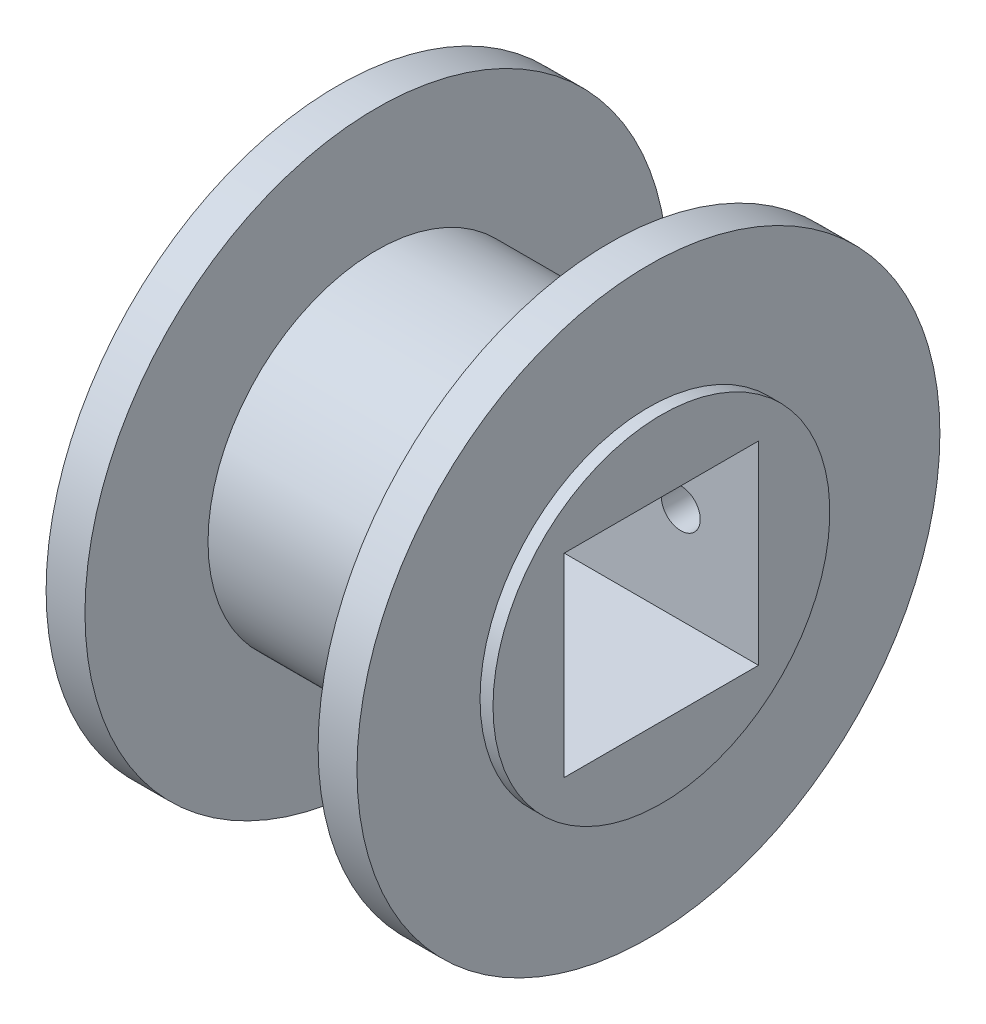
from build123d import *

# Parameters (mm, degrees)
SCHIZZO2_W               = 15
SCHIZZO2_H               = 15
TAGLIO_ESTRUSIONE1_DEPTH = 42.091361623
SCHIZZO3_R               = 1.5
TAGLIO_ESTRUSIONE2_DEPTH = 35.372954485


with BuildPart() as part:
    # Schizzo1 → Rivoluzione1 (revolve)
    with BuildSketch(Plane.XY, mode=Mode.PRIVATE) as rivoluzione1_sk:
        Polygon((-13, 0), (13, 0), (13, 13), (12, 13), (12, 22.5), (9, 22.5), (9, 13), (-9, 13), (-9, 22.5), (-12, 22.5), (-12, 13), (-13, 13), align=None)
    revolve(rivoluzione1_sk.sketch.rotate(Axis((-15.70924178, 0, 0), (1, 0, 0)), 90), axis=Axis((-15.70924178, 0, 0), (1, 0, 0)))

    # Schizzo2 → Taglio-Estrusione1 (cut, through all)
    with BuildSketch(Plane.ZY.offset(13)):
        Rectangle(SCHIZZO2_W, SCHIZZO2_H)
    extrude(amount=-TAGLIO_ESTRUSIONE1_DEPTH, mode=Mode.SUBTRACT)

    # Schizzo3 → Taglio-Estrusione2 (cut, through all)
    with BuildSketch(Plane.XY):
        with Locations((7, 0)):
            Circle(SCHIZZO3_R)
    extrude(amount=-TAGLIO_ESTRUSIONE2_DEPTH, mode=Mode.SUBTRACT)


solid = part.part
